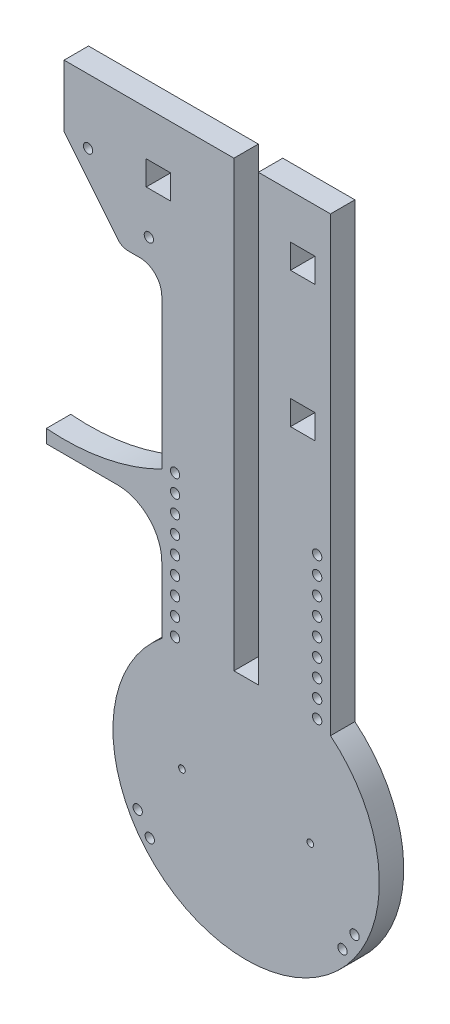
from build123d import *

# Parameters (mm, degrees)
EXTRUDE_1_DEPTH     = 5.5
FILLET_2_R          = 5
SKETCH_5_R          = 0.75
CUT_EXTRUDE_3_DEPTH = 133.967101194
SKETCH_6_R          = 1.05
CUT_EXTRUDE_4_DEPTH = 133.967101194
SKETCH_7_R          = 1.05
CUT_EXTRUDE_5_DEPTH = 133.967101194
FILLET_3_R          = 3
FILLET_4_R          = 10
SKETCH_8_W          = 5.5
SKETCH_8_H          = 5.5
CUT_EXTRUDE_6_DEPTH = 133.967101194
SKETCH_9_R          = 1.05
CUT_EXTRUDE_7_DEPTH = 133.967101194
SKETCH_10_W         = 5.5
SKETCH_10_H         = 100
CUT_EXTRUDE_8_DEPTH = 133.967101194


with BuildPart() as part:
    # ｽｹｯﾁ1 → ﾎﾞｽ - 押し出し1 (new body)
    with BuildSketch(Plane.XY):
        with BuildLine():
            Line((19, 125), (-41, 125))
            Line((-41, 125), (-41, 111))
            Line((-41, 111), (-28, 95))
            Line((-28, 95), (-19, 95))
            Line((-19, 95), (-19, 56.216441442))
            ThreePointArc((-19, 56.216441442), (-31.652114797, 51.899926796), (-45, 51.163538212))
            Line((-45, 51.163538212), (-45, 48.163538212))
            Line((-45, 48.163538212), (-19, 48.163538212))
            Line((-19, 48.163538212), (-19, 23.216373532))
            ThreePointArc((-19, 23.216373532), (0, -30), (19, 23.216373532))
            Line((19, 23.216373532), (19, 125))
        make_face()
    extrude(amount=EXTRUDE_1_DEPTH)

    # ﾌｨﾚｯﾄ2
    fillet_2_edges = [part.edges().sort_by_distance(p)[0] for p in [
        (-19, 95, 2.75),
    ]]
    fillet(fillet_2_edges, radius=FILLET_2_R)

    # ｽｹｯﾁ5 → ｶｯﾄ - 押し出し3 (cut, through all)
    with BuildSketch(Plane.XY.offset(5.5)):
        with Locations((14.45, 0)):
            Circle(SKETCH_5_R)
        with Locations((-14.45, 0)):
            Circle(SKETCH_5_R)
    extrude(amount=-CUT_EXTRUDE_3_DEPTH, mode=Mode.SUBTRACT)

    # ｽｹｯﾁ6 → ｶｯﾄ - 押し出し4 (cut, through all)
    with BuildSketch(Plane.XY.offset(5.5)):
        with Locations((-24.425038206, -12.880897043)):
            Circle(SKETCH_6_R)
        with Locations((-21.701843031, -17.074249883)):
            Circle(SKETCH_6_R)
        with Locations(Location((24.425038206, -12.880897043, 0), (0, 0, 180))):
            Circle(SKETCH_6_R)
        with Locations(Location((21.701843031, -17.074249883, 0), (0, 0, 180))):
            Circle(SKETCH_6_R)
    extrude(amount=-CUT_EXTRUDE_4_DEPTH, mode=Mode.SUBTRACT)

    # ｽｹｯﾁ7 → ｶｯﾄ - 押し出し5 (cut, through all)
    with BuildSketch(Plane.XY.offset(5.5)):
        with Locations((-21.9, 100)):
            Circle(SKETCH_7_R)
        with Locations((-35.6, 110.5)):
            Circle(SKETCH_7_R)
    extrude(amount=-CUT_EXTRUDE_5_DEPTH, mode=Mode.SUBTRACT)

    # ﾌｨﾚｯﾄ3
    fillet_3_edges = [part.edges().sort_by_distance(p)[0] for p in [
        (-28, 95, 2.75),
    ]]
    fillet(fillet_3_edges, radius=FILLET_3_R)

    # ﾌｨﾚｯﾄ4
    fillet_4_edges = [part.edges().sort_by_distance(p)[0] for p in [
        (-19, 48.163538212, 2.75),
    ]]
    fillet(fillet_4_edges, radius=FILLET_4_R)

    # ｽｹｯﾁ8 → ｶｯﾄ - 押し出し6 (cut, through all)
    with BuildSketch(Plane.XY.offset(5.5)):
        with Locations((12.75, 112.25)):
            Rectangle(SKETCH_8_W, SKETCH_8_H)
        with Locations((-19.75, 112.25)):
            Rectangle(SKETCH_8_W, SKETCH_8_H)
        with Locations((12.75, 81.75)):
            Rectangle(SKETCH_8_W, SKETCH_8_H)
    extrude(amount=-CUT_EXTRUDE_6_DEPTH, mode=Mode.SUBTRACT)

    # ｽｹｯﾁ9 → ｶｯﾄ - 押し出し7 (cut, through all)
    with BuildSketch(Plane.XY.offset(5.5)):
        with Locations((16, 25)):
            Circle(SKETCH_9_R)
        with Locations((16, 29)):
            Circle(SKETCH_9_R)
        with Locations((16, 33)):
            Circle(SKETCH_9_R)
        with Locations((16, 37)):
            Circle(SKETCH_9_R)
        with Locations((16, 41)):
            Circle(SKETCH_9_R)
        with Locations((16, 45)):
            Circle(SKETCH_9_R)
        with Locations((16, 49)):
            Circle(SKETCH_9_R)
        with Locations((16, 53)):
            Circle(SKETCH_9_R)
        with Locations((16, 57)):
            Circle(SKETCH_9_R)
        with Locations(Location((-16, 57, 0), (0, 0, 180))):
            Circle(SKETCH_9_R)
        with Locations(Location((-16, 53, 0), (0, 0, 180))):
            Circle(SKETCH_9_R)
        with Locations(Location((-16, 49, 0), (0, 0, 180))):
            Circle(SKETCH_9_R)
        with Locations(Location((-16, 45, 0), (0, 0, 180))):
            Circle(SKETCH_9_R)
        with Locations(Location((-16, 41, 0), (0, 0, 180))):
            Circle(SKETCH_9_R)
        with Locations(Location((-16, 37, 0), (0, 0, 180))):
            Circle(SKETCH_9_R)
        with Locations(Location((-16, 33, 0), (0, 0, 180))):
            Circle(SKETCH_9_R)
        with Locations(Location((-16, 29, 0), (0, 0, 180))):
            Circle(SKETCH_9_R)
        with Locations(Location((-16, 25, 0), (0, 0, 180))):
            Circle(SKETCH_9_R)
    extrude(amount=-CUT_EXTRUDE_7_DEPTH, mode=Mode.SUBTRACT)

    # ｽｹｯﾁ10 → ｶｯﾄ - 押し出し8 (cut, through all)
    with BuildSketch(Plane.XY.offset(5.5)):
        with Locations((0, 75)):
            Rectangle(SKETCH_10_W, SKETCH_10_H)
    extrude(amount=-CUT_EXTRUDE_8_DEPTH, mode=Mode.SUBTRACT)


solid = part.part
